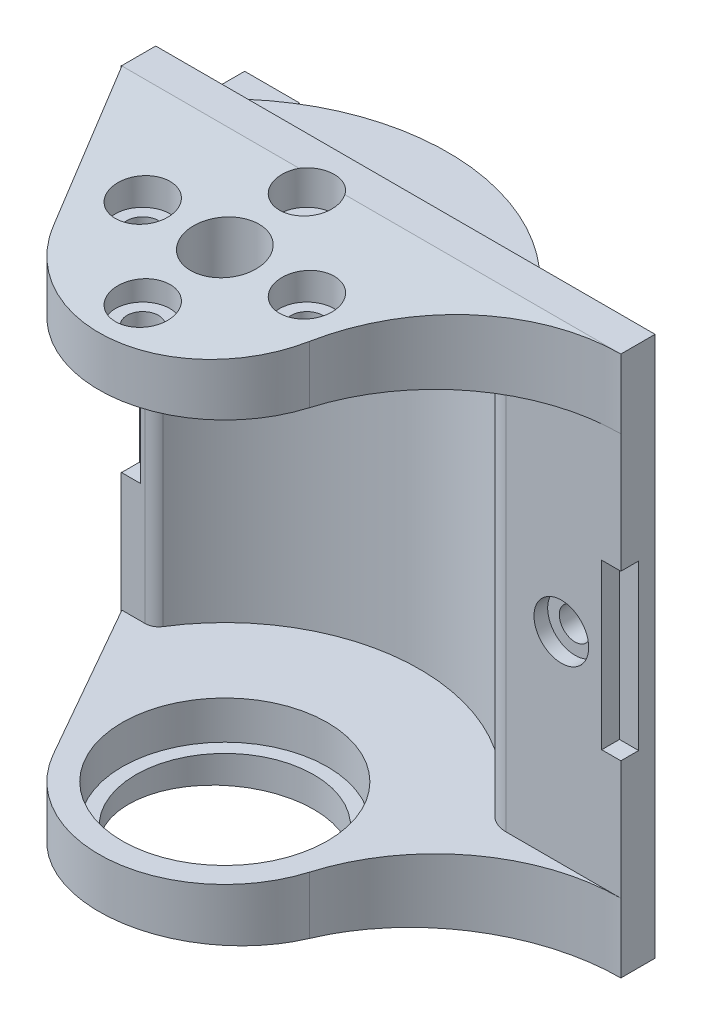
from build123d import *

# Parameters (mm, degrees)
SKETCH_1_R               = 16.3
EXTRUDE_1_DEPTH          = 19.75
SKETCH_2_W               = 36.5
SKETCH_2_H               = 2.5
EXTRUDE_2_DEPTH          = 39.5
SKETCH_3_W               = 44.844436064
SKETCH_3_H               = 25.506740045
CUT_EXTRUDE_1_DEPTH      = 50
EXTRUDE_3_DEPTH          = 5.05
SKETCH_5_R               = 14.25
CUT_EXTRUDE_2_DEPTH      = 29.4
SKETCH_6_R               = 7.5
CUT_EXTRUDE_3_DEPTH      = 44.930797853
SKETCH_8_R               = 1.15
CUT_EXTRUDE_5_DEPTH      = 5.05
PATTERN_CIRCULAR_1_COUNT = 4
CUT_EXTRUDE_6_REACH      = 49.993
SKETCH_9_R               = 2.5
SKETCH_10_R              = 2
CUT_EXTRUDE_7_DEPTH      = 2.5
EXTRUDE_START            = -2.25
SKETCH_11_R              = 7.5
SKETCH_11_R_2            = 6.5
EXTRUDE_4_DEPTH          = 2.25
SKETCH_12_R              = 1.15
CUT_EXTRUDE_9_DEPTH      = 34.662664779
SKETCH_13_R              = 2
CUT_EXTRUDE_10_DEPTH     = 1
SKETCH_14_W              = 2.8
SKETCH_14_H              = 12
CUT_EXTRUDE_11_DEPTH     = 1.3
SKETCH_15_W              = 2.8
SKETCH_15_H              = 12
CUT_EXTRUDE_12_DEPTH     = 1.3
EXTRUDE_5_REACH          = 40.183
EXTRUDE_5_END_RADIUS     = 16.3
SKETCH_16_W              = 4
SKETCH_16_H              = 5
SKETCH_17_W              = 1
SKETCH_17_H              = 2
CUT_EXTRUDE_13_DEPTH     = 2.5
CUT_EXTRUDE_8_DEPTH      = 45.587021654
SKETCH_18_W              = 26.346157216
SKETCH_18_H              = 2.75
CUT_EXTRUDE_16_DEPTH     = 12.5
FILLET_1_R               = 2
FILLET_2_R               = 1


with BuildPart() as part:
    # 草图1 → 凸台-拉伸1 (new, symmetric)
    with BuildSketch(Plane(origin=(0, 0, 0), x_dir=(1, 0, 0), z_dir=(0, 1, 0))):
        with Locations(Location((0, 0, 0), (0, 0, 270))):
            Circle(SKETCH_1_R)
    extrude(amount=EXTRUDE_1_DEPTH, both=True)

    # 草图2 → 凸台-拉伸2 (add, through all)
    with BuildSketch(Plane.XZ.offset(19.75)):
        with Locations((3.6, -8.35)):
            Rectangle(SKETCH_2_W, SKETCH_2_H)
    extrude(amount=-EXTRUDE_2_DEPTH)

    # 草图3 → 切除-拉伸1 (cut)
    with BuildSketch(Plane.XZ.offset(19.75)):
        with Locations((-0.572218032, 5.653370022)):
            Rectangle(SKETCH_3_W, SKETCH_3_H)
    extrude(amount=-CUT_EXTRUDE_1_DEPTH, mode=Mode.SUBTRACT)

    # 草图4 → 凸台-拉伸3 (add)
    with BuildSketch(Plane.XZ.offset(19.75)):
        with BuildLine():
            Line((-14.65, -7.146152811), (-7.996542478, 4.549209646))
            ThreePointArc((-7.996542478, 4.549209646), (1.047927533, 9.140122969), (8.818653972, 2.621324497))
            ThreePointArc((8.818653972, 2.621324497), (13.721037439, -4.401937543), (21.85, -7.1))
            Line((21.85, -7.1), (-14.65, -7.146152811))
        make_face()
    extrude_3 = extrude(amount=-EXTRUDE_3_DEPTH)

    # 镜向1: 凸台-拉伸3 across plane
    add(extrude_3.mirror(Plane.ZX))

    # 草图5 → 切除-拉伸2 (cut)
    with BuildSketch(Plane(origin=(0, -14.7, 0), x_dir=(1, 0, 0), z_dir=(0, 1, 0))):
        Circle(SKETCH_5_R)
    extrude(amount=CUT_EXTRUDE_2_DEPTH, mode=Mode.SUBTRACT)

    # 草图6 → 切除-拉伸3 (cut, through all)
    with BuildSketch(Plane(origin=(0, -14.7, 0), x_dir=(1, 0, 0), z_dir=(0, 1, 0))):
        with Locations(Location((0, 0, 0), (0, 0, 270))):
            Circle(SKETCH_6_R)
    extrude(amount=-CUT_EXTRUDE_3_DEPTH, mode=Mode.SUBTRACT)

    # 草图8 → 切除-拉伸5 (cut)
    with BuildSketch(Plane(origin=(0, 19.75, 0), x_dir=(1, 0, 0), z_dir=(0, 1, 0))):
        with Locations(Location((0, -6, 0), (0, 0, 270))):
            Circle(SKETCH_8_R)
    cut_extrude_5 = extrude(amount=-CUT_EXTRUDE_5_DEPTH, mode=Mode.SUBTRACT)

    # 阵列(圆周)1: 切除-拉伸5 ×4 about axis
    pattern_circular_1_axis = Axis((0, 0, 0), (0, 1, 0))
    for i in range(1, PATTERN_CIRCULAR_1_COUNT):
        add(cut_extrude_5.rotate(pattern_circular_1_axis, i * 360 / PATTERN_CIRCULAR_1_COUNT), mode=Mode.SUBTRACT)

    # 草图9 → 切除-拉伸6 (cut, up to next)
    with BuildSketch(Plane(origin=(0, 19.75, 0), x_dir=(1, 0, 0), z_dir=(0, 1, 0)), mode=Mode.PRIVATE) as cut_extrude_6_sk1:
        with Locations(Location((0, 0, 0), (0, 0, 270))):
            Circle(SKETCH_9_R)
    cut_extrude_6_tool1 = extrude(cut_extrude_6_sk1.sketch, amount=-CUT_EXTRUDE_6_REACH, mode=Mode.PRIVATE) & part.part
    add(cut_extrude_6_tool1.solids().sort_by_distance((0, 19.75, 0))[0], mode=Mode.SUBTRACT)

    # 草图10 → 切除-拉伸7 (cut)
    with BuildSketch(Plane(origin=(0, 19.75, 0), x_dir=(1, 0, 0), z_dir=(0, 1, 0))):
        with Locations(Location((0, 6, 0), (0, 0, 270))):
            Circle(SKETCH_10_R)
        with Locations(Location((6, 0, 0), (0, 0, 270))):
            Circle(SKETCH_10_R)
        with Locations(Location((-6, 0, 0), (0, 0, 270))):
            Circle(SKETCH_10_R)
        with Locations(Location((0, -6, 0), (0, 0, 270))):
            Circle(SKETCH_10_R)
    extrude(amount=-CUT_EXTRUDE_7_DEPTH, mode=Mode.SUBTRACT)

    # 草图11 → 凸台-拉伸4 (add)
    with BuildSketch(Plane.XZ.offset(19.75).offset(EXTRUDE_START)):
        with Locations(Location((0, 0, 0), (0, 0, 90))):
            Circle(SKETCH_11_R)
        with Locations(Location((0, 0, 0), (0, 0, 270))):
            Circle(SKETCH_11_R_2, mode=Mode.SUBTRACT)
    extrude(amount=EXTRUDE_4_DEPTH)

    # 草图12 → 切除-拉伸9 (cut, through all)
    with BuildSketch(Plane.XY.offset(-7.1)):
        with Locations((17.5, 0)):
            Circle(SKETCH_12_R)
    extrude(amount=-CUT_EXTRUDE_9_DEPTH, mode=Mode.SUBTRACT)

    # 草图13 → 切除-拉伸10 (cut)
    with BuildSketch(Plane.XY.offset(-7.1)):
        with Locations((17.5, 0)):
            Circle(SKETCH_13_R)
    extrude(amount=-CUT_EXTRUDE_10_DEPTH, mode=Mode.SUBTRACT)

    # 草图14 → 切除-拉伸11 (cut)
    with BuildSketch(Plane.XY.offset(-7.1)):
        with Locations((21.85, 0)):
            Rectangle(SKETCH_14_W, SKETCH_14_H)
    extrude(amount=-CUT_EXTRUDE_11_DEPTH, mode=Mode.SUBTRACT)

    # 草图15 → 切除-拉伸12 (cut)
    with BuildSketch(Plane.XY.offset(-7.1)):
        with Locations((-14.672423113, 0)):
            Rectangle(SKETCH_15_W, SKETCH_15_H)
    extrude(amount=-CUT_EXTRUDE_12_DEPTH, mode=Mode.SUBTRACT)

    # 凸台-拉伸5: up to this cylinder (the profile starts outside it)
    extrude_5_end = Plane(origin=(0, 13.4, 0), z_dir=(0, -1, 0)) * Cylinder(EXTRUDE_5_END_RADIUS, 113.966, mode=Mode.PRIVATE)
    # 草图16 → 凸台-拉伸5 (add, up to the surface)
    with BuildSketch(Plane(origin=(0, 0, -15.1), x_dir=(-1, 0, 0), z_dir=(0, 0, -1)), mode=Mode.PRIVATE) as extrude_5_sk1:
        with Locations((11.65, 13.4)):
            Rectangle(SKETCH_16_W, SKETCH_16_H)
    extrude_5_tool1 = extrude(extrude_5_sk1.sketch, amount=-EXTRUDE_5_REACH, mode=Mode.PRIVATE) - extrude_5_end
    extrude_5 = extrude_5_tool1.solids().sort_by_distance((-11.65, 13.4, -15.1))[0]
    add(extrude_5)

    # 镜向4: 凸台-拉伸5 across plane
    add(extrude_5.mirror(Plane.ZX))

    # 草图17 → 切除-拉伸13 (cut)
    with BuildSketch(Plane(origin=(0, 0, -15.1), x_dir=(-1, 0, 0), z_dir=(0, 0, -1))):
        with Locations((11.65, 13.4)):
            Rectangle(SKETCH_17_W, SKETCH_17_H)
    cut_extrude_13 = extrude(amount=-CUT_EXTRUDE_13_DEPTH, mode=Mode.SUBTRACT)

    # 镜向5: 切除-拉伸13 across plane
    add(cut_extrude_13.mirror(Plane.ZX), mode=Mode.SUBTRACT)

    # 草图7 → 切除-拉伸8 (cut, through all)
    with BuildSketch(Plane.ZY.offset(14.65)):
        Polygon((-7.1, 19.75), (9.2, 18.323934785), (9.2, 19.75), align=None)
    cut_extrude_8 = extrude(amount=-CUT_EXTRUDE_8_DEPTH, mode=Mode.SUBTRACT)

    # 镜向3: 切除-拉伸8 across plane
    add(cut_extrude_8.mirror(Plane.ZX), mode=Mode.SUBTRACT)

    # 草图18 → 切除-拉伸16 (cut)
    with BuildSketch(Plane(origin=(0, 0, -9.6), x_dir=(-1, 0, 0), z_dir=(0, 0, -1))):
        with Locations((0, 18.375)):
            Rectangle(SKETCH_18_W, SKETCH_18_H)
    cut_extrude_16 = extrude(amount=CUT_EXTRUDE_16_DEPTH, mode=Mode.SUBTRACT)

    # 镜向6: 切除-拉伸16 across plane
    add(cut_extrude_16.mirror(Plane.ZX), mode=Mode.SUBTRACT)

    # 圆角1
    fillet_1_edges = [part.edges().sort_by_distance(p)[0] for p in [
        (12.355262037, 0, -7.1),
    ]]
    fillet(fillet_1_edges, radius=FILLET_1_R)

    # 圆角2
    fillet_2_edges = [part.edges().sort_by_distance(p)[0] for p in [
        (-12.355262037, 0, -7.1),
    ]]
    fillet(fillet_2_edges, radius=FILLET_2_R)


solid = part.part
